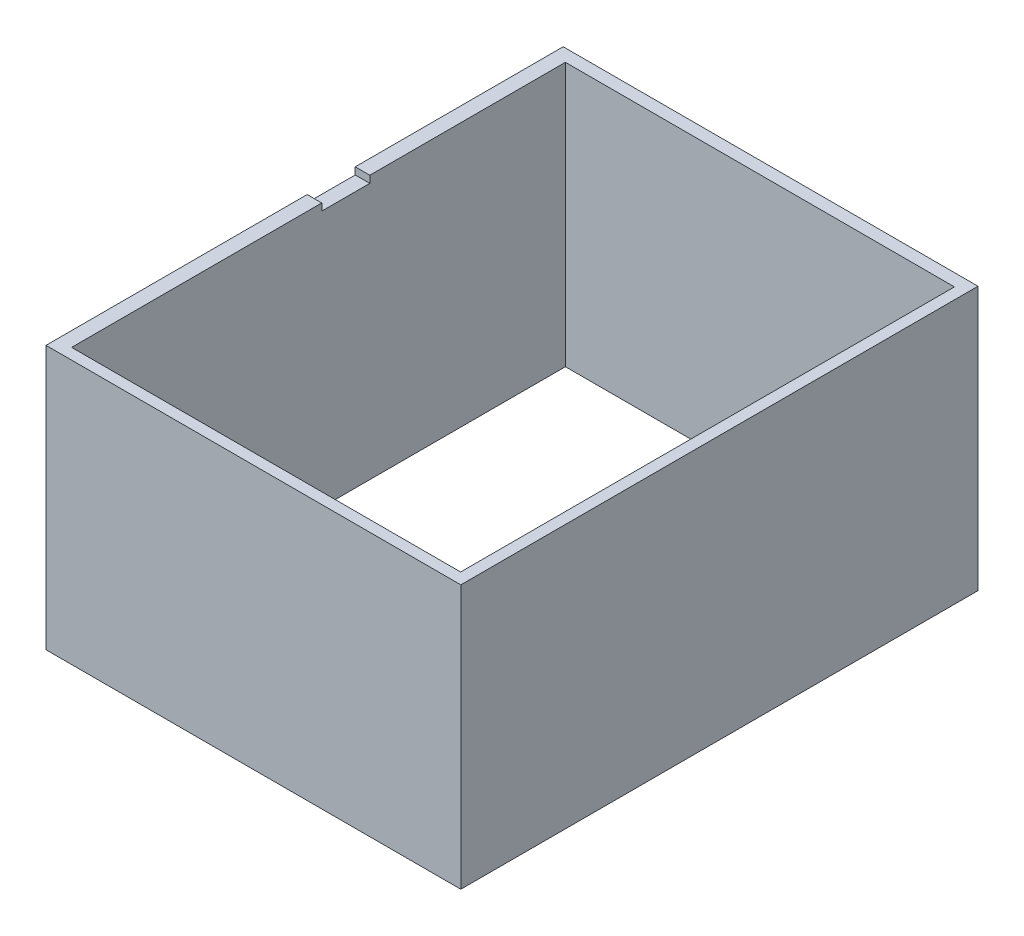
from build123d import *

# Parameters (mm, degrees)
SKETCH1_W           = 5879.492687141
SKETCH1_H           = 7330.915568067
SKETCH1_W_2         = 5514
SKETCH1_H_2         = 6999
BOSS_EXTRUDE1_DEPTH = 3737
SKETCH2_W           = 1168.362513452
SKETCH2_H           = 680.312349606
CUT_EXTRUDE1_DEPTH  = 100


with BuildPart() as part:
    # Sketch1 → Boss-Extrude1 (new body)
    with BuildSketch(Plane(origin=(0, 0, 0), x_dir=(1, 0, 0), z_dir=(0, 1, 0))):
        with Locations((2733.201192899, 3508.938162482)):
            Rectangle(SKETCH1_W, SKETCH1_H)
        with Locations((2757, 3499.5)):
            Rectangle(SKETCH1_W_2, SKETCH1_H_2, mode=Mode.SUBTRACT)
    extrude(amount=BOSS_EXTRUDE1_DEPTH)

    # Sketch2 → Cut-Extrude1 (cut)
    with BuildSketch(Plane(origin=(0, 3737, 0), x_dir=(-1, 0, 0), z_dir=(0, 1, 0))):
        with Locations((81.738058405, -3886.067834545)):
            Rectangle(SKETCH2_W, SKETCH2_H)
    extrude(amount=-CUT_EXTRUDE1_DEPTH, mode=Mode.SUBTRACT)


solid = part.part
